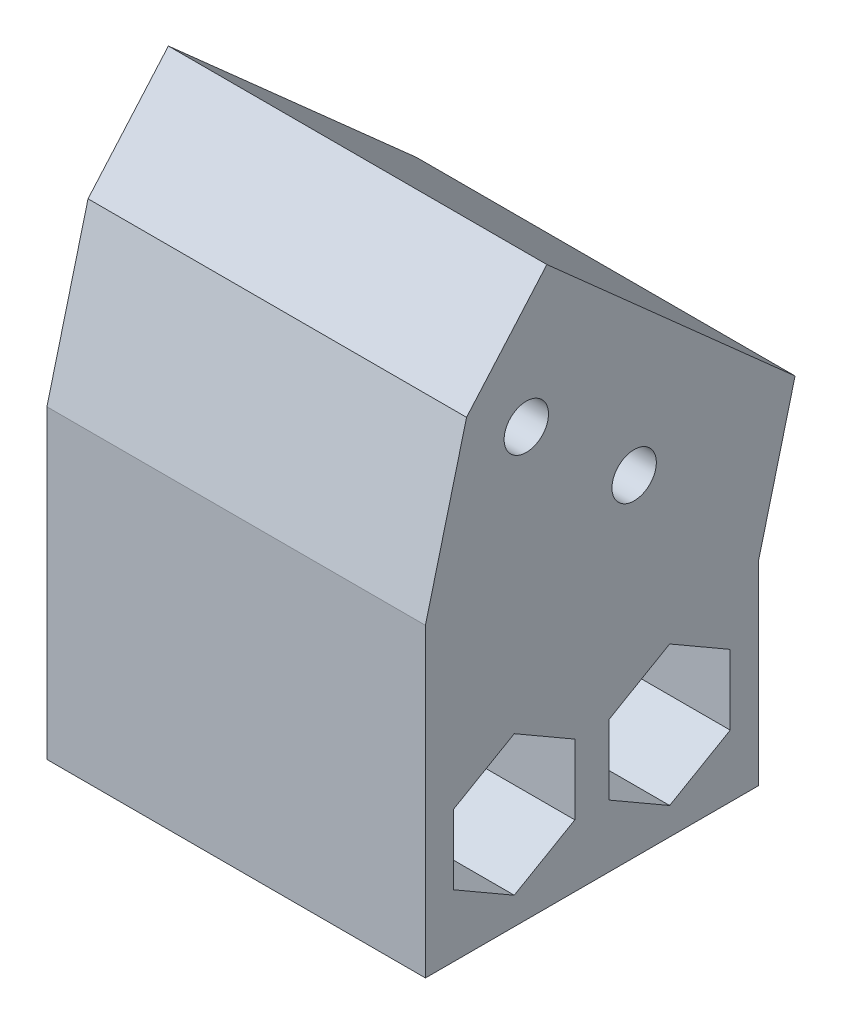
from build123d import *

# Parameters (mm, degrees)
SKETCH1_R           = 1
BOSS_EXTRUDE1_DEPTH = 17.05
CHAMFER3_SIZE       = 2
SKETCH4_R           = 1.411016709
CUT_EXTRUDE2_DEPTH  = 35.812450989
CUT_EXTRUDE3_DEPTH  = 35.812450989
CUT_EXTRUDE4_DEPTH  = 10


with BuildPart() as part:
    # Sketch1 → Boss-Extrude1 (new body)
    with BuildSketch(Plane(origin=(0, 0, 0), x_dir=(0, 0, -1), z_dir=(1, 0, 0))):
        Polygon((-7.5, 0), (7.5, 0), (7.5, 10.76), (9.149426619, 17.160897736), (-4.103828097, 28.939458123), (-7.5, 15.76), align=None)
        with Locations((-2.957491833, 21.231429279)):
            Circle(SKETCH1_R, mode=Mode.SUBTRACT)
        with Locations((1.901052893, 16.913496539)):
            Circle(SKETCH1_R, mode=Mode.SUBTRACT)
    extrude(amount=BOSS_EXTRUDE1_DEPTH)

    # Chamfer3
    chamfer3_edges = [part.edges().sort_by_distance(p)[0] for p in [
        (8.525, 0, 7.5),
        (17.05, 0, 0),
    ]]
    chamfer(chamfer3_edges, length=CHAMFER3_SIZE)

    # Sketch4 → Cut-Extrude2 (cut, through all)
    with BuildSketch(Plane(origin=(17.05, 0, 0), x_dir=(0, 0, -1), z_dir=(1, 0, 0))):
        with Locations((-3.500000028, 6.380001803)):
            Circle(SKETCH4_R)
        with Locations((3.5, 6.380001848)):
            Circle(SKETCH4_R)
    extrude(amount=-CUT_EXTRUDE2_DEPTH, mode=Mode.SUBTRACT)

    # Sketch5 → Cut-Extrude3 (cut, through all)
    with BuildSketch(Plane(origin=(17.05, 0, 0), x_dir=(0, 0, -1), z_dir=(1, 0, 0))):
        Polygon((-4.103828097, 28.939458123), (-2.03016404, 27.096531397), (-5.648400148, 22.945467464), align=None)
    extrude(amount=-CUT_EXTRUDE3_DEPTH, mode=Mode.SUBTRACT)

    # Sketch6 → Cut-Extrude4 (cut)
    with BuildSketch(Plane(origin=(17.05, 0, 0), x_dir=(0, 0, -1), z_dir=(1, 0, 0))):
        Polygon((-3.500000028, 3.230001803), (-0.772020006, 4.805001803), (-0.772020006, 7.955001803), (-3.500000028, 9.530001803), (-6.22798005, 7.955001803), (-6.22798005, 4.805001803), align=None)
        Polygon((6.22798005, 4.805001803), (3.500000028, 3.230001803), (0.772020006, 4.805001803), (0.772020006, 7.955001803), (3.500000028, 9.530001803), (6.22798005, 7.955001803), align=None)
    extrude(amount=-CUT_EXTRUDE4_DEPTH, mode=Mode.SUBTRACT)


solid = part.part
